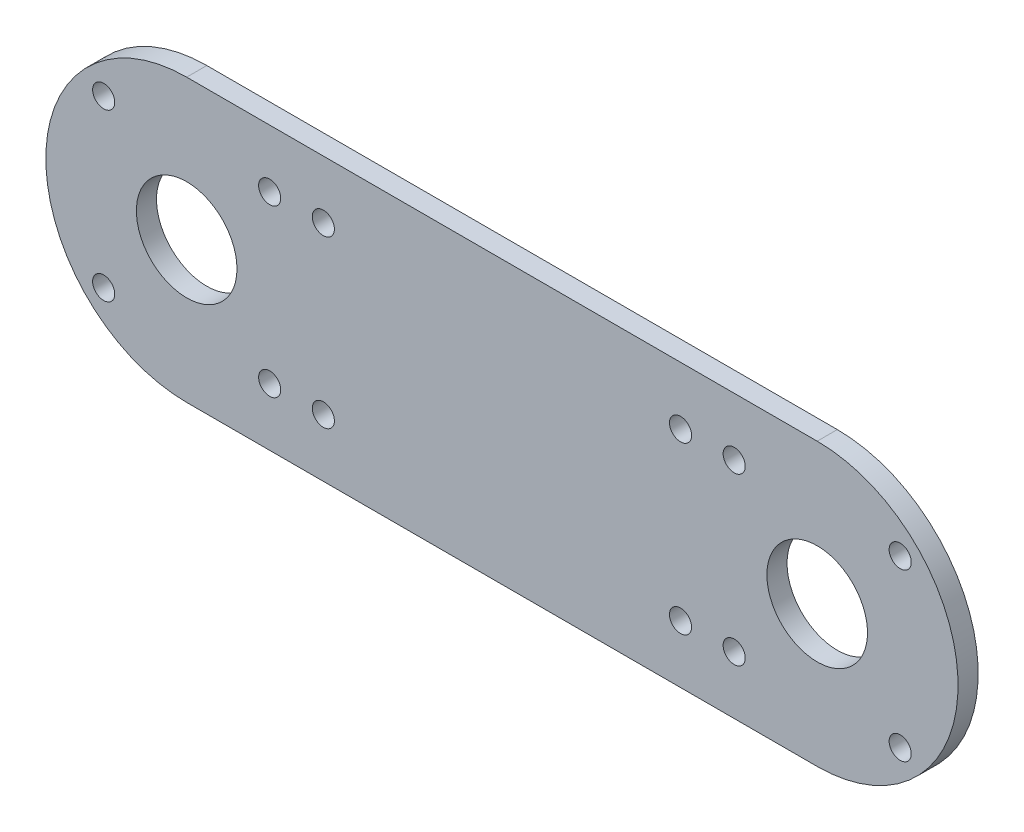
from build123d import *

# Parameters (mm, degrees)
SKETCH_1_W          = 165
SKETCH_1_H          = 42
SKETCH_1_R          = 7.5
SKETCH_1_R_2        = 1.65
EXTRUDE_1_DEPTH     = 3
CUT_EXTRUDE_1_DEPTH = 3
SKETCH_3_R          = 1.65
CUT_EXTRUDE_2_DEPTH = 3


with BuildPart() as part:
    # 草图1 → 凸台-拉伸1 (new body)
    with BuildSketch(Plane.XY):
        Rectangle(SKETCH_1_W, SKETCH_1_H)
        with Locations((-47, 0)):
            Circle(SKETCH_1_R, mode=Mode.SUBTRACT)
        with Locations((-75, 10)):
            Circle(SKETCH_1_R_2, mode=Mode.SUBTRACT)
        with Locations((-75, -10)):
            Circle(SKETCH_1_R_2, mode=Mode.SUBTRACT)
        with Locations((75, 10)):
            Circle(SKETCH_1_R_2, mode=Mode.SUBTRACT)
        with Locations((75, -10)):
            Circle(SKETCH_1_R_2, mode=Mode.SUBTRACT)
        with Locations((-59.374368671, 12.374368671)):
            Circle(SKETCH_1_R_2, mode=Mode.SUBTRACT)
        with Locations((-34.625631329, 12.374368671)):
            Circle(SKETCH_1_R_2, mode=Mode.SUBTRACT)
        with Locations((-34.625631329, -12.374368671)):
            Circle(SKETCH_1_R_2, mode=Mode.SUBTRACT)
        with Locations((-59.374368671, -12.374368671)):
            Circle(SKETCH_1_R_2, mode=Mode.SUBTRACT)
        with Locations(Location((59.374368671, -12.374368671, 0), (0, 0, 180))):
            Circle(SKETCH_1_R_2, mode=Mode.SUBTRACT)
        with Locations(Location((34.625631329, -12.374368671, 0), (0, 0, 180))):
            Circle(SKETCH_1_R_2, mode=Mode.SUBTRACT)
        with Locations(Location((34.625631329, 12.374368671, 0), (0, 0, 180))):
            Circle(SKETCH_1_R_2, mode=Mode.SUBTRACT)
        with Locations(Location((59.374368671, 12.374368671, 0), (0, 0, 180))):
            Circle(SKETCH_1_R_2, mode=Mode.SUBTRACT)
        with Locations(Location((47, 0, 0), (0, 0, 180))):
            Circle(SKETCH_1_R, mode=Mode.SUBTRACT)
    extrude(amount=EXTRUDE_1_DEPTH)

    # 草图2 → 切除-拉伸1 (cut)
    with BuildSketch(Plane.XY.offset(3)):
        with BuildLine():
            Line((-47, 21), (-82.5, 21))
            Line((-82.5, 21), (-82.5, -21))
            Line((-82.5, -21), (-47, -21))
            ThreePointArc((-47, -21), (-68, 0), (-47, 21))
        make_face()
        with BuildLine():
            Line((47, -21), (82.5, -21))
            Line((82.5, -21), (82.5, 21))
            Line((82.5, 21), (47, 21))
            ThreePointArc((47, 21), (68, 0), (47, -21))
        make_face()
    extrude(amount=-CUT_EXTRUDE_1_DEPTH, mode=Mode.SUBTRACT)

    # 草图3 → 切除-拉伸2 (cut)
    with BuildSketch(Plane.XY.offset(3)):
        with Locations((-26.625631329, 12.374368671)):
            Circle(SKETCH_3_R)
        with Locations((-26.625631329, -12.374368671)):
            Circle(SKETCH_3_R)
        with Locations((26.625631329, 12.374368671)):
            Circle(SKETCH_3_R)
        with Locations((26.625631329, -12.374368671)):
            Circle(SKETCH_3_R)
    extrude(amount=-CUT_EXTRUDE_2_DEPTH, mode=Mode.SUBTRACT)


solid = part.part
